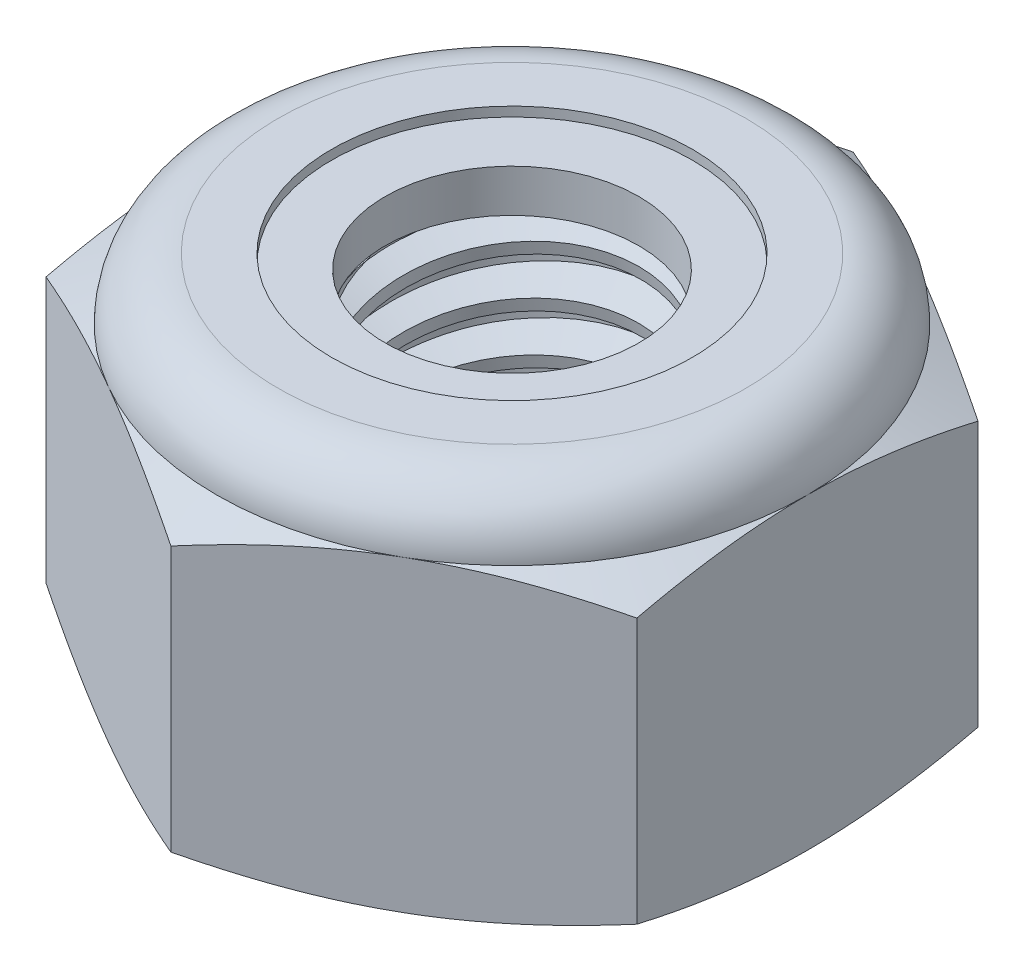
from build123d import *

# Parameters (mm, degrees)
EXTRUDE1_DEPTH      = 5.953125
SKETCH2_W           = 2.413
SKETCH2_H           = 5.953125
LPATTERN1_COUNT     = 8
LPATTERN1_PITCH     = 0.79375
LPATTERN1_COL_COUNT = 2
LPATTERN1_COL_PITCH = 0.79375


with BuildPart() as part:
    # Sketch1 → Extrude1 (new body)
    with BuildSketch(Plane(origin=(0, 0, 0), x_dir=(1, 0, 0), z_dir=(0, 1, 0))):
        Polygon((0, 5.499261314), (-4.7625, 2.749630657), (-4.7625, -2.749630657), (0, -5.499261314), (4.7625, -2.749630657), (4.7625, 2.749630657), align=None)
    extrude(amount=EXTRUDE1_DEPTH)

    # Sketch4 → Cut-Revolve2 (revolve, cut)
    with BuildSketch(Plane(origin=(0, 0, 0), x_dir=(0, 0, -1), z_dir=(1, 0, 0)), mode=Mode.PRIVATE) as cut_revolve2_sk:
        Polygon((0, 5.953125), (2.413, 5.953125), (2.045424837, 5.781721887), (2.045424837, 0.171403113), (2.413, 0), (0, 0), align=None)
    revolve(cut_revolve2_sk.sketch.rotate(Axis((0, 5.953125, 0), (0, 1, 0)), 55.135741266), axis=Axis((0, 5.953125, 0), (0, 1, 0)), mode=Mode.SUBTRACT)


with BuildPart() as body_2:
    # Sketch2 → Revolve1 (revolve)
    with BuildSketch(Plane(origin=(0, 0, 0), x_dir=(0, 0, -1), z_dir=(1, 0, 0))):
        with Locations((1.2065, 2.9765625)):
            Rectangle(SKETCH2_W, SKETCH2_H)
    revolve(axis=Axis((0, -2.413, 0), (0, 1, 0)))

    # Sketch3 → Cut-Revolve1 (revolve, cut)
    with BuildSketch(Plane(origin=(0, 0, 0), x_dir=(0, 0, -1), z_dir=(1, 0, 0)), mode=Mode.PRIVATE) as cut_revolve1_sk:
        Polygon((2.429102527, 5.855221635), (2.541820218, 5.169898076), (2.077629892, 5.344930502), (2.045424837, 5.540737233), align=None)
    cut_revolve1 = revolve(cut_revolve1_sk.sketch.rotate(Axis((0, 5.953125, 0.139697061), (0, -0.9867425810390564, -0.1622931876708978)), 180), axis=Axis((0, 5.953125, 0.139697061), (0, -0.9867425810390564, -0.1622931876708978)), mode=Mode.SUBTRACT)

    # LPattern1: Cut-Revolve1 ×8
    with Locations(*[(0, -i * LPATTERN1_PITCH, 0) for i in range(1, LPATTERN1_COUNT)]):
        add(cut_revolve1, mode=Mode.SUBTRACT)

    # LPattern1 col: Cut-Revolve1 ×2
    with Locations(*[(0, i * LPATTERN1_COL_PITCH, 0) for i in range(1, LPATTERN1_COL_COUNT)]):
        add(cut_revolve1, mode=Mode.SUBTRACT)


with BuildPart() as part_1:
    add(part.part)

    # Combine1: cut body 2
    add(body_2.part, mode=Mode.SUBTRACT)

    # Sketch5 → Cut-Revolve3 (revolve, cut)
    with BuildSketch(Plane(origin=(0, 0, 0), x_dir=(0, 0, -1), z_dir=(1, 0, 0)), mode=Mode.PRIVATE) as cut_revolve3_sk:
        with BuildLine():
            Line((0, 0), (4.7625, 0))
            Line((4.7625, 0), (5.499261314, 0.343557443))
            Line((5.499261314, 0.343557443), (5.499261314, 4.617380057))
            Line((5.499261314, 4.617380057), (4.7625, 4.9609375))
            ThreePointArc((4.7625, 4.9609375), (4.471895009, 5.662520009), (3.7703125, 5.953125))
            Line((3.7703125, 5.953125), (3.7703125, 7.223125))
            Line((3.7703125, 7.223125), (6.769261314, 7.223125))
            Line((6.769261314, 7.223125), (6.769261314, -1.27))
            Line((6.769261314, -1.27), (0, -1.27))
            Line((0, -1.27), (0, 0))
        make_face()
    revolve(cut_revolve3_sk.sketch.rotate(Axis((0, 0, 0), (0, 1, 0)), 55.135741266), axis=Axis((0, 0, 0), (0, 1, 0)), mode=Mode.SUBTRACT)

    # Sketch6 → Cut-Revolve4 (revolve, cut)
    with BuildSketch(Plane(origin=(0, 0, 0), x_dir=(0, 0, -1), z_dir=(1, 0, 0)), mode=Mode.PRIVATE) as cut_revolve4_sk:
        with BuildLine():
            Line((0, 4.9609375), (4.6101, 4.9609375))
            ThreePointArc((4.6101, 4.9609375), (4.364131936, 5.554756936), (3.7703125, 5.800725))
            Line((3.7703125, 5.800725), (2.907868669, 5.800725))
            Line((2.907868669, 5.800725), (2.907868669, 7.223125))
            Line((2.907868669, 7.223125), (0, 7.223125))
            Line((0, 7.223125), (0, 4.9609375))
        make_face()
    revolve(cut_revolve4_sk.sketch.rotate(Axis((0, 7.223125, 0), (0, 1, 0)), 55.135741266), axis=Axis((0, 7.223125, 0), (0, 1, 0)), mode=Mode.SUBTRACT)


with BuildPart() as body_2_2:
    # Sketch7 → Revolve2 (revolve)
    with BuildSketch(Plane(origin=(0, 0, 0), x_dir=(0, 0, -1), z_dir=(1, 0, 0))):
        with BuildLine():
            Line((2.045424837, 5.0371375), (4.530088408, 5.0371375))
            ThreePointArc((4.530088408, 5.0371375), (4.282601726, 5.527175629), (3.7703125, 5.724525))
            Line((3.7703125, 5.724525), (2.045424837, 5.724525))
            Line((2.045424837, 5.724525), (2.045424837, 5.0371375))
        make_face()
    revolve(axis=Axis((0, 5.0371375, 0), (0, 1, 0)))


solid = Compound([part_1.part, body_2_2.part])
